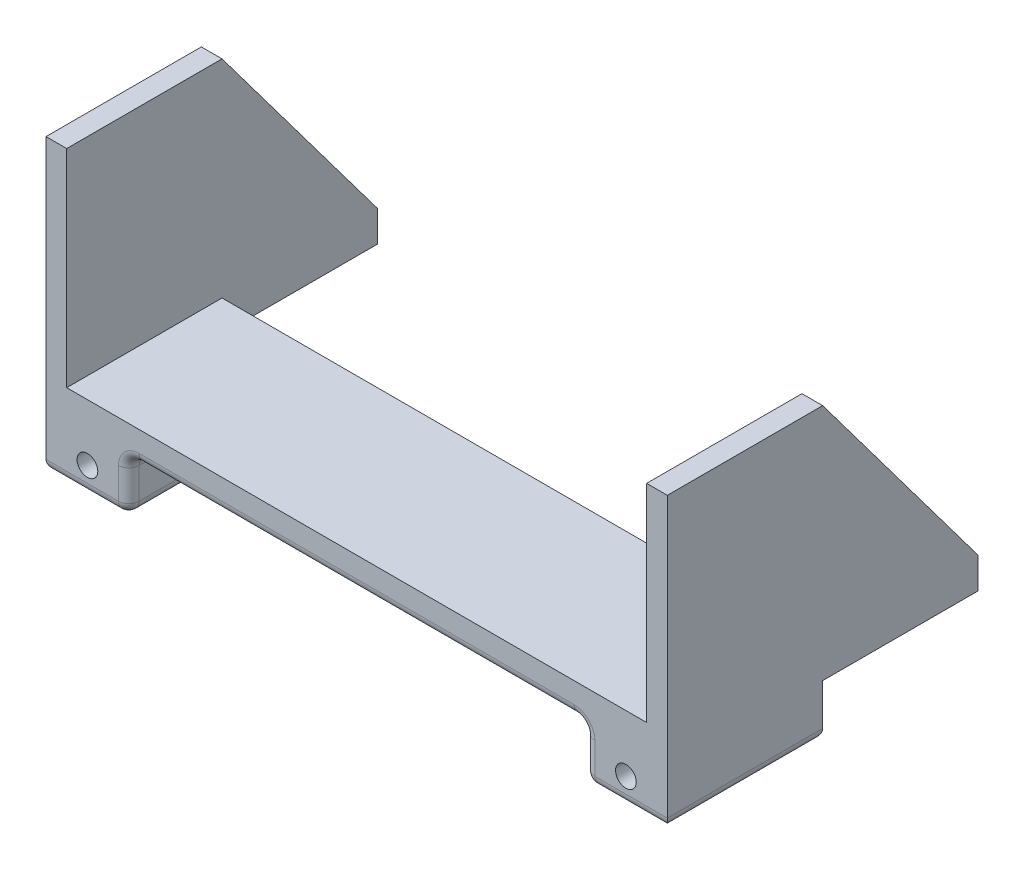
from build123d import *

# Parameters (mm, degrees)
EXTRUDE_1_DEPTH          = 300
CUT_EXTRUDE_1_DEPTH      = 688.477272352
CUT_EXTRUDE_1_DEPTH_BACK = 688.477272352
SKETCH_3_W               = 560
SKETCH_3_H               = 150
CUT_EXTRUDE_2_DEPTH      = 470.041575982
EXTRUDE_2_DEPTH          = 50
FILLET_1_R               = 10
CUT_EXTRUDE_3_DEPTH      = 476.631159618
CUT_EXTRUDE_3_DEPTH_BACK = 476.631159618
SKETCH_5_R               = 10


with BuildPart() as part:
    # Эскиз1 → Бобышка-Вытянуть1 (new body)
    with BuildSketch(Plane.XY):
        Polygon((-300, -15), (-300, 0), (-300, 215), (-280, 215), (-280, 15), (280, 15), (280, 215), (300, 215), (300, 0), (300, -15), align=None)
    extrude(amount=EXTRUDE_1_DEPTH)

    # Эскиз2 → Вырез-Вытянуть1 (cut, two sides: drawn at the far end of the back side and taken through both)
    with BuildSketch(Plane(origin=(-280, 0, 0), x_dir=(0, 0, -1), z_dir=(1, 0, 0)).offset(-CUT_EXTRUDE_1_DEPTH_BACK)):
        Polygon((-150, 215), (0, 15), (0, 215), align=None)
    extrude(amount=CUT_EXTRUDE_1_DEPTH + CUT_EXTRUDE_1_DEPTH_BACK, mode=Mode.SUBTRACT)

    # Эскиз3 → Вырез-Вытянуть2 (cut, through all)
    with BuildSketch(Plane(origin=(0, 15, 0), x_dir=(1, 0, 0), z_dir=(0, 1, 0))):
        with Locations((0, -75)):
            Rectangle(SKETCH_3_W, SKETCH_3_H)
    extrude(amount=-CUT_EXTRUDE_2_DEPTH, mode=Mode.SUBTRACT)

    # Эскиз4 → Бобышка-Вытянуть2 (add)
    with BuildSketch(Plane.XZ.offset(15)):
        Polygon((-220, 300), (-300, 300), (-300, 150), (-280, 150), (-220, 150), align=None)
        Polygon((300, 300), (220, 300), (220, 150), (280, 150), (300, 150), align=None)
    extrude(amount=EXTRUDE_2_DEPTH)

    # Скругление1
    fillet_1_edges = [part.edges().sort_by_distance(p)[0] for p in [
        (0, -15, 150),
        (-220, -65, 225),
        (-220, -40, 150),
        (-220, -40, 300),
        (-260, -65, 150),
        (-260, -65, 300),
        (-300, -65, 225),
        (-220, -15, 225),
        (0, -15, 300),
        (220, -15, 225),
        (220, -40, 300),
        (220, -40, 150),
        (260, -65, 300),
        (220, -65, 225),
        (260, -65, 150),
        (300, -65, 225),
    ]]
    fillet(fillet_1_edges, radius=FILLET_1_R)

    # Эскиз5 → Вырез-Вытянуть3 (cut, two sides: drawn at the far end of the back side and taken through both)
    with BuildSketch(Plane.XY.offset(300).offset(-CUT_EXTRUDE_3_DEPTH_BACK)):
        with Locations((-260, -40)):
            Circle(SKETCH_5_R)
        with Locations((260, -40)):
            Circle(SKETCH_5_R)
    extrude(amount=CUT_EXTRUDE_3_DEPTH + CUT_EXTRUDE_3_DEPTH_BACK, mode=Mode.SUBTRACT)


solid = part.part
